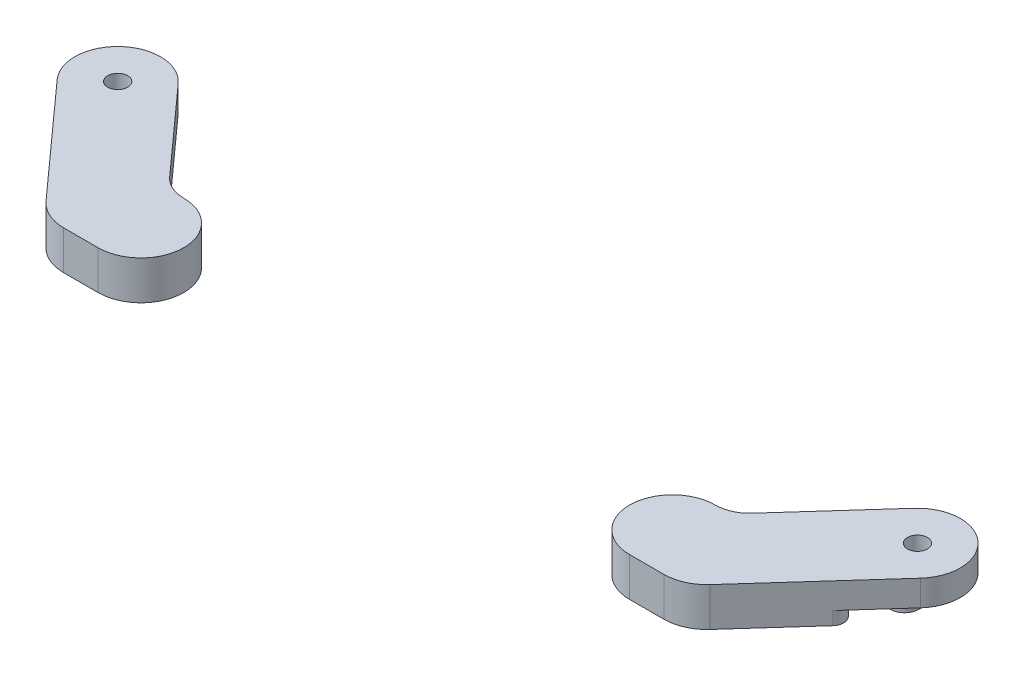
from build123d import *

# Parameters (mm, degrees)
BOSS_EXTRUDE1_DEPTH = 9
CUT_EXTRUDE1_DEPTH  = 220.600022769
BOSS_EXTRUDE2_DEPTH = 6.3
BOSS_EXTRUDE3_DEPTH = 4.6
SKETCH7_R           = 3.5
CUT_EXTRUDE2_DEPTH  = 9


with BuildPart() as part:
    # Sketch1 → Boss-Extrude1 (new body)
    with BuildSketch(Plane(origin=(0, 0, 0), x_dir=(1, 0, 0), z_dir=(0, 1, 0))):
        with BuildLine():
            Line((-128.747729842, 150.431294549), (-101.892422534, 120.574964361))
            ThreePointArc((-101.892422534, 120.574964361), (-97.854230693, 117.638694702), (-92.970606408, 116.6))
            Line((-92.970606408, 116.6), (92.970606408, 116.6))
            ThreePointArc((92.970606408, 116.6), (97.854230693, 117.638694702), (101.892422534, 120.574964361))
            Line((101.892422534, 120.574964361), (128.747729842, 150.431294549))
            ThreePointArc((128.747729842, 150.431294549), (149.931294549, 151.552270158), (151.052270158, 130.368705451))
            Line((151.052270158, 130.368705451), (116.152270158, 91.568705451))
            ThreePointArc((116.152270158, 91.568705451), (111.104530357, 87.898368378), (105, 86.6))
            Line((105, 86.6), (-105, 86.6))
            ThreePointArc((-105, 86.6), (-111.104530357, 87.898368378), (-116.152270158, 91.568705451))
            Line((-116.152270158, 91.568705451), (-151.052270158, 130.368705451))
            ThreePointArc((-151.052270158, 130.368705451), (-149.931294549, 151.552270158), (-128.747729842, 150.431294549))
        make_face()
    extrude(amount=BOSS_EXTRUDE1_DEPTH)

    # Sketch3 → Cut-Extrude1 (cut, through all)
    with BuildSketch(Plane(origin=(0, 9, 0), x_dir=(1, 0, 0), z_dir=(0, 1, 0))):
        with BuildLine():
            Line((-92.970606408, 116.6), (92.970606408, 116.6))
            ThreePointArc((92.970606408, 116.6), (77.970606408, 101.6), (92.970606408, 86.6))
            Line((92.970606408, 86.6), (-92.970606408, 86.6))
            ThreePointArc((-92.970606408, 86.6), (-77.970606408, 101.6), (-92.970606408, 116.6))
        make_face()
    extrude(amount=-CUT_EXTRUDE1_DEPTH, mode=Mode.SUBTRACT)


with BuildPart() as cut_extrude1_piece_1:
    # of the separate pieces the step leaves, piece 1, a body of its own (cut_extrude1_pieces)
    add(part.part.solids().sort_by_distance((92.970606408, 0, -116.6))[0])



with BuildPart() as cut_extrude1_piece_2:
    # of the separate pieces the step leaves, piece 2, a body of its own (cut_extrude1_pieces)
    add(part.part.solids().sort_by_distance((-128.747729842, 0, -150.431294549))[0])


with BuildPart() as cut_extrude1_piece_1_1:
    add(cut_extrude1_piece_1.part)

    add(cut_extrude1_piece_2.part)  # Boss-Extrude2 merges Cut-Extrude1 piece 2
    # Sketch4 → Boss-Extrude2 (add)
    with BuildSketch(Plane.XZ):
        with BuildLine():
            Line((-134.9, -135.9), (-134.9, -144.9))
            ThreePointArc((-134.9, -144.9), (-139.9, -149.9), (-144.9, -144.9))
            Line((-144.9, -144.9), (-144.9, -135.9))
            ThreePointArc((-144.9, -135.9), (-139.9, -130.9), (-134.9, -135.9))
        make_face()
        with BuildLine():
            Line((144.9, -135.9), (144.9, -144.9))
            ThreePointArc((144.9, -144.9), (139.9, -149.9), (134.9, -144.9))
            Line((134.9, -144.9), (134.9, -135.9))
            ThreePointArc((134.9, -135.9), (139.9, -130.9), (144.9, -135.9))
        make_face()
    extrude(amount=BOSS_EXTRUDE2_DEPTH)

    # Sketch6 → Boss-Extrude3 (add)
    with BuildSketch(Plane.XZ):
        with BuildLine():
            Line((-133.557307355, -120.9), (-103.884359199, -120.9))
            ThreePointArc((-103.884359199, -120.9), (-102.41807137, -120.621558813), (-101.155921001, -119.825))
            ThreePointArc((-101.155921001, -119.825), (-97.369469897, -117.43532356), (-92.970606408, -116.6))
            ThreePointArc((-92.970606408, -116.6), (-77.970606408, -101.6), (-92.970606408, -86.6))
            Line((-92.970606408, -86.6), (-105, -86.6))
            ThreePointArc((-105, -86.6), (-111.104530357, -87.898368378), (-116.152270158, -91.568705451))
            Line((-116.152270158, -91.568705451), (-136.531246064, -114.22498812))
            ThreePointArc((-136.531246064, -114.22498812), (-137.211075788, -118.527874762), (-133.557307355, -120.9))
        make_face()
        with BuildLine():
            Line((103.884359199, -120.9), (133.557307355, -120.9))
            ThreePointArc((133.557307355, -120.9), (137.211075788, -118.527874762), (136.531246064, -114.22498812))
            Line((136.531246064, -114.22498812), (116.152270158, -91.568705451))
            ThreePointArc((116.152270158, -91.568705451), (111.104530357, -87.898368378), (105, -86.6))
            Line((105, -86.6), (92.970606408, -86.6))
            ThreePointArc((92.970606408, -86.6), (77.970606408, -101.6), (92.970606408, -116.6))
            ThreePointArc((92.970606408, -116.6), (97.369469897, -117.43532356), (101.155921001, -119.825))
            ThreePointArc((101.155921001, -119.825), (102.41807137, -120.621558813), (103.884359199, -120.9))
        make_face()
    extrude(amount=BOSS_EXTRUDE3_DEPTH)

    # Sketch7 → Cut-Extrude2 (cut)
    with BuildSketch(Plane(origin=(0, 9, 0), x_dir=(1, 0, 0), z_dir=(0, 1, 0))):
        with Locations((-139.9, 140.4)):
            Circle(SKETCH7_R)
        with Locations((139.9, 140.4)):
            Circle(SKETCH7_R)
    extrude(amount=-CUT_EXTRUDE2_DEPTH, mode=Mode.SUBTRACT)


solid = cut_extrude1_piece_1_1.part
